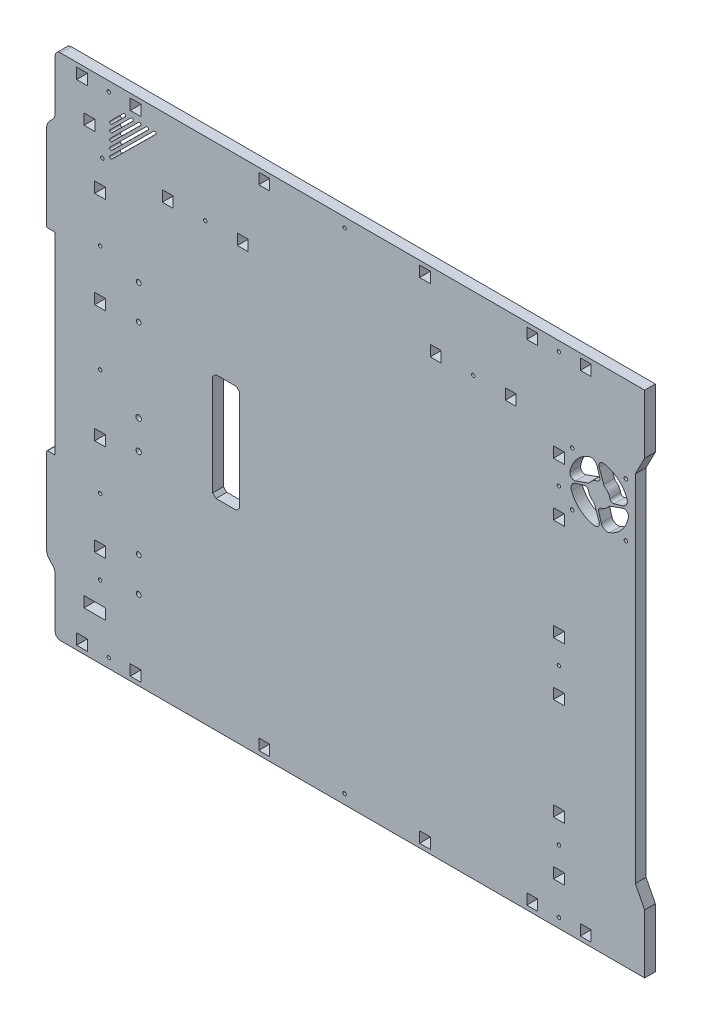
from build123d import *

# Parameters (mm, degrees)
SKETCH_1_R      = 1.6
SKETCH_1_R_2    = 2.25
SKETCH_1_R_3    = 2.5
SKETCH_1_W      = 10.1
SKETCH_1_H      = 10
SKETCH_1_W_2    = 10
SKETCH_1_H_2    = 10.1
SKETCH_1_W_3    = 20.1
EXTRUDE_1_DEPTH = 10


with BuildPart() as part:
    # Эскиз1 → Бобышка-Вытянуть1 (new body)
    with BuildSketch(Plane.XY):
        with BuildLine():
            Line((-929.093421233, 509.89377355), (-929.093421233, 464.03591955))
            ThreePointArc((-929.093421233, 464.03591955), (-929.854625881, 460.209077628), (-932.022357114, 456.964837669))
            Line((-932.022357114, 456.964837669), (-934.164489044, 454.822705739))
            ThreePointArc((-934.164489044, 454.822705739), (-936.332216558, 451.57847225), (-937.093421233, 447.751637925))
            Line((-937.093421233, 447.751637925), (-937.093421233, 368.393773551))
            ThreePointArc((-937.093421233, 368.393773551), (-936.800528014, 367.686666769), (-936.093421232, 367.39377355))
            Line((-936.093421232, 367.39377355), (-929.093421233, 367.39377355))
            Line((-929.093421233, 367.39377355), (-929.093421233, 187.39377355))
            Line((-929.093421233, 187.39377355), (-936.093421233, 187.39377355))
            ThreePointArc((-936.093421233, 187.39377355), (-936.800528014, 187.100880331), (-937.093421233, 186.39377355))
            Line((-937.093421233, 186.39377355), (-937.093421233, 107.035909174))
            ThreePointArc((-937.093421233, 107.035909174), (-936.332216558, 103.20907485), (-934.164489045, 99.964841362))
            Line((-934.164489045, 99.964841362), (-932.022353421, 97.822705738))
            ThreePointArc((-932.022353421, 97.822705738), (-929.854625836, 94.578472076), (-929.093421233, 90.75163755))
            Line((-929.093421233, 90.75163755), (-929.093421233, 44.89377355))
            ThreePointArc((-929.093421233, 44.89377355), (-927.628955139, 41.358239644), (-924.093421233, 39.89377355))
            Line((-924.093421233, 39.89377355), (-379.093421233, 39.89377355))
            Line((-379.093421233, 39.89377355), (-379.093421233, 94.89377355))
            Line((-379.093421233, 94.89377355), (-387.823678233, 111.89377355))
            Line((-387.823678233, 111.89377355), (-387.823678233, 442.89377355))
            Line((-387.823678233, 442.89377355), (-379.093421233, 459.89377355))
            Line((-379.093421233, 459.89377355), (-379.093421233, 514.89377355))
            Line((-379.093421233, 514.89377355), (-924.093421233, 514.89377355))
            ThreePointArc((-924.093421233, 514.89377355), (-927.628955139, 513.429307456), (-929.093421233, 509.89377355))
        make_face()
        with Locations((-887.143421236, 377.39377355)):
            Circle(SKETCH_1_R, mode=Mode.SUBTRACT)
        with Locations((-459.093421233, 48.843773546)):
            Circle(SKETCH_1_R, mode=Mode.SUBTRACT)
        with Locations((-659.093421233, 48.843773546)):
            Circle(SKETCH_1_R, mode=Mode.SUBTRACT)
        with Locations((-887.143421236, 177.39377355)):
            Circle(SKETCH_1_R, mode=Mode.SUBTRACT)
        with Locations((-885.143421235, 449.393773548)):
            Circle(SKETCH_1_R, mode=Mode.SUBTRACT)
        with Locations((-879.093421233, 505.943773546)):
            Circle(SKETCH_1_R, mode=Mode.SUBTRACT)
        with Locations((-659.093421233, 505.943773546)):
            Circle(SKETCH_1_R, mode=Mode.SUBTRACT)
        with Locations((-459.093421233, 505.943773546)):
            Circle(SKETCH_1_R, mode=Mode.SUBTRACT)
        with Locations((-879.093421233, 48.843773546)):
            Circle(SKETCH_1_R, mode=Mode.SUBTRACT)
        with Locations((-887.143421236, 107.39377355)):
            Circle(SKETCH_1_R, mode=Mode.SUBTRACT)
        with Locations((-459.141096235, 107.39377355)):
            Circle(SKETCH_1_R, mode=Mode.SUBTRACT)
        with Locations((-459.141096235, 397.39377355)):
            Circle(SKETCH_1_R, mode=Mode.SUBTRACT)
        with Locations((-887.143421236, 277.39377355)):
            Circle(SKETCH_1_R, mode=Mode.SUBTRACT)
        with Locations((-446.683386839, 434.428585952)):
            Circle(SKETCH_1_R, mode=Mode.SUBTRACT)
        with Locations((-446.683386839, 384.428585952)):
            Circle(SKETCH_1_R, mode=Mode.SUBTRACT)
        with Locations((-396.683386839, 384.428585952)):
            Circle(SKETCH_1_R, mode=Mode.SUBTRACT)
        with Locations((-396.683386839, 434.428585952)):
            Circle(SKETCH_1_R, mode=Mode.SUBTRACT)
        with Locations((-789.093421233, 446.843773548)):
            Circle(SKETCH_1_R, mode=Mode.SUBTRACT)
        with Locations((-539.093421233, 446.843773548)):
            Circle(SKETCH_1_R, mode=Mode.SUBTRACT)
        with Locations((-459.141096235, 252.39377355)):
            Circle(SKETCH_1_R, mode=Mode.SUBTRACT)
        with Locations((-851.191096233, 113.89377355)):
            Circle(SKETCH_1_R_2, mode=Mode.SUBTRACT)
        with Locations((-851.191096233, 365.89377355)):
            Circle(SKETCH_1_R_2, mode=Mode.SUBTRACT)
        with Locations((-851.191096233, 333.89377355)):
            Circle(SKETCH_1_R_2, mode=Mode.SUBTRACT)
        with Locations((-851.191096233, 145.89377355)):
            Circle(SKETCH_1_R_2, mode=Mode.SUBTRACT)
        with Locations((-851.191096233, 256.39377355)):
            Circle(SKETCH_1_R_3, mode=Mode.SUBTRACT)
        with Locations((-851.191096233, 229.39377355)):
            Circle(SKETCH_1_R_3, mode=Mode.SUBTRACT)
        with Locations((-459.141096233, 422.39377355)):
            Rectangle(SKETCH_1_W, SKETCH_1_H, mode=Mode.SUBTRACT)
        with Locations((-459.141096233, 372.39377355)):
            Rectangle(SKETCH_1_W, SKETCH_1_H, mode=Mode.SUBTRACT)
        with Locations((-459.141096233, 132.39377355)):
            Rectangle(SKETCH_1_W, SKETCH_1_H, mode=Mode.SUBTRACT)
        with Locations((-459.141096233, 82.39377355)):
            Rectangle(SKETCH_1_W, SKETCH_1_H, mode=Mode.SUBTRACT)
        with Locations((-734.093421233, 505.94377355)):
            Rectangle(SKETCH_1_W_2, SKETCH_1_H_2, mode=Mode.SUBTRACT)
        with Locations((-734.093421233, 48.84377355)):
            Rectangle(SKETCH_1_W_2, SKETCH_1_H_2, mode=Mode.SUBTRACT)
        with Locations((-434.093421233, 48.84377355)):
            Rectangle(SKETCH_1_W_2, SKETCH_1_H_2, mode=Mode.SUBTRACT)
        with Locations((-434.093421233, 505.94377355)):
            Rectangle(SKETCH_1_W_2, SKETCH_1_H_2, mode=Mode.SUBTRACT)
        with Locations((-584.093421233, 505.94377355)):
            Rectangle(SKETCH_1_W_2, SKETCH_1_H_2, mode=Mode.SUBTRACT)
        with Locations((-584.093421233, 48.84377355)):
            Rectangle(SKETCH_1_W_2, SKETCH_1_H_2, mode=Mode.SUBTRACT)
        with Locations((-904.093421233, 505.94377355)):
            Rectangle(SKETCH_1_W_2, SKETCH_1_H_2, mode=Mode.SUBTRACT)
        with Locations((-904.093421233, 48.84377355)):
            Rectangle(SKETCH_1_W_2, SKETCH_1_H_2, mode=Mode.SUBTRACT)
        with Locations((-854.093421233, 505.94377355)):
            Rectangle(SKETCH_1_W_2, SKETCH_1_H_2, mode=Mode.SUBTRACT)
        with Locations((-854.093421233, 48.84377355)):
            Rectangle(SKETCH_1_W_2, SKETCH_1_H_2, mode=Mode.SUBTRACT)
        with Locations((-484.093421233, 505.94377355)):
            Rectangle(SKETCH_1_W_2, SKETCH_1_H_2, mode=Mode.SUBTRACT)
        with Locations((-484.093421233, 48.84377355)):
            Rectangle(SKETCH_1_W_2, SKETCH_1_H_2, mode=Mode.SUBTRACT)
        with Locations((-887.143421233, 422.39377355)):
            Rectangle(SKETCH_1_W, SKETCH_1_H, mode=Mode.SUBTRACT)
        with Locations((-892.143421233, 82.39377355)):
            Rectangle(SKETCH_1_W_3, SKETCH_1_H, mode=Mode.SUBTRACT)
        with Locations((-887.143421233, 332.39377355)):
            Rectangle(SKETCH_1_W, SKETCH_1_H, mode=Mode.SUBTRACT)
        with Locations((-897.143421233, 472.39377355)):
            Rectangle(SKETCH_1_W, SKETCH_1_H, mode=Mode.SUBTRACT)
        with Locations((-887.143421233, 132.39377355)):
            Rectangle(SKETCH_1_W, SKETCH_1_H, mode=Mode.SUBTRACT)
        with Locations((-887.143421233, 222.39377355)):
            Rectangle(SKETCH_1_W, SKETCH_1_H, mode=Mode.SUBTRACT)
        with BuildLine():
            Line((-858.328175233, 495.28288155), (-877.880747233, 475.94517355))
            ThreePointArc((-877.880747233, 475.94517355), (-877.890513233, 474.17743355), (-876.122773233, 474.16766755))
            Line((-876.122773233, 474.16766755), (-856.570202233, 493.50537555))
            ThreePointArc((-856.570202233, 493.50537555), (-856.560435733, 495.27311505), (-858.328175233, 495.28288155))
        make_face(mode=Mode.SUBTRACT)
        with BuildLine():
            Line((-851.257215233, 495.24381555), (-877.919813233, 468.87421355))
            ThreePointArc((-877.919813233, 468.87421355), (-877.929579233, 467.10647355), (-876.161839233, 467.09670755))
            Line((-876.161839233, 467.09670755), (-849.499242233, 493.46630855))
            ThreePointArc((-849.499242233, 493.46630855), (-849.489475233, 495.23404855), (-851.257215233, 495.24381555))
        make_face(mode=Mode.SUBTRACT)
        with BuildLine():
            Line((-844.186255233, 495.20474955), (-877.958879233, 461.80325355))
            ThreePointArc((-877.958879233, 461.80325355), (-877.968645233, 460.03551355), (-876.200905233, 460.02574755))
            Line((-876.200905233, 460.02574755), (-842.428282233, 493.42724255))
            ThreePointArc((-842.428282233, 493.42724255), (-842.418515233, 495.19498255), (-844.186255233, 495.20474955))
        make_face(mode=Mode.SUBTRACT)
        with BuildLine():
            Line((-865.399135233, 495.32194755), (-877.841680233, 483.01613355))
            ThreePointArc((-877.841680233, 483.01613355), (-877.851447233, 481.24839355), (-876.083707233, 481.23862655))
            Line((-876.083707233, 481.23862655), (-863.641162233, 493.54444155))
            ThreePointArc((-863.641162233, 493.54444155), (-863.631395733, 495.31218105), (-865.399135233, 495.32194755))
        make_face(mode=Mode.SUBTRACT)
        with BuildLine():
            Line((-837.115295233, 495.16568355), (-877.997945233, 454.73229355))
            ThreePointArc((-877.997945233, 454.73229355), (-878.007711233, 452.96455355), (-876.239971233, 452.95478755))
            Line((-876.239971233, 452.95478755), (-835.357322233, 493.38817655))
            ThreePointArc((-835.357322233, 493.38817655), (-835.347555233, 495.15591655), (-837.115295233, 495.16568355))
        make_face(mode=Mode.SUBTRACT)
        with BuildLine():
            Line((-399.539905644, 409.221839367), (-411.183069054, 405.065078589))
            ThreePointArc((-411.183069054, 405.065078589), (-412.282484032, 404.464226206), (-413.142089647, 403.552735632))
            ThreePointArc((-413.142089647, 403.552735632), (-415.988899826, 400.766347373), (-419.688045631, 399.288305412))
            ThreePointArc((-419.688045631, 399.288305412), (-421.694837974, 397.914928206), (-422.024651545, 395.505653736))
            Line((-422.024651545, 395.505653736), (-419.667803229, 387.347850599))
            ThreePointArc((-419.667803229, 387.347850599), (-416.593086965, 383.649757054), (-411.790357577, 383.397633294))
            ThreePointArc((-411.790357577, 383.397633294), (-400.145093494, 391.74928922), (-394.247315867, 404.809861617))
            ThreePointArc((-394.247315867, 404.809861617), (-395.633747128, 408.52717755), (-399.539905644, 409.221839367))
        make_face(mode=Mode.SUBTRACT)
        with BuildLine():
            Line((-443.532023242, 409.340487651), (-431.888858878, 413.497247383))
            ThreePointArc((-431.888858878, 413.497247383), (-430.789443697, 414.098099757), (-429.929837927, 415.009590423))
            ThreePointArc((-429.929837927, 415.009590423), (-427.083027946, 417.795978469), (-423.383882448, 419.274020417))
            ThreePointArc((-423.383882448, 419.274020417), (-421.377090162, 420.6473977), (-421.047276682, 423.056672176))
            Line((-421.047276682, 423.056672176), (-423.404125673, 431.214476535))
            ThreePointArc((-423.404125673, 431.214476535), (-426.478842018, 434.912569941), (-431.281571357, 435.164693594))
            ThreePointArc((-431.281571357, 435.164693594), (-442.926835116, 426.813037703), (-448.824612618, 413.752465561))
            ThreePointArc((-448.824612618, 413.752465561), (-447.438181529, 410.035149751), (-443.532023242, 409.340487651))
        make_face(mode=Mode.SUBTRACT)
        with BuildLine():
            Line((-421.476640331, 431.27722225), (-417.319879462, 419.634057789))
            ThreePointArc((-417.319879462, 419.634057789), (-416.719027081, 418.534642769), (-415.807536488, 417.675037122))
            ThreePointArc((-415.807536488, 417.675037122), (-413.021148441, 414.828227243), (-411.543106427, 411.12908185))
            ThreePointArc((-411.543106427, 411.12908185), (-410.16972917, 409.122289655), (-407.760454788, 408.792476139))
            Line((-407.760454788, 408.792476139), (-399.602651327, 411.149324549))
            ThreePointArc((-399.602651327, 411.149324549), (-395.904557782, 414.224040813), (-395.652434022, 419.0267702))
            ThreePointArc((-395.652434022, 419.0267702), (-404.004090043, 430.672034362), (-417.064662588, 436.56981195))
            ThreePointArc((-417.064662588, 436.56981195), (-420.781978469, 435.183380703), (-421.476640331, 431.27722225))
        make_face(mode=Mode.SUBTRACT)
        with BuildLine():
            Line((-421.579768269, 387.296319461), (-425.736529137, 398.939483921))
            ThreePointArc((-425.736529137, 398.939483921), (-426.337381518, 400.038898942), (-427.248872111, 400.898504588))
            ThreePointArc((-427.248872111, 400.898504588), (-430.03526035, 403.745314762), (-431.5133023, 407.444460551))
            ThreePointArc((-431.5133023, 407.444460551), (-432.886679507, 409.451252894), (-435.295953976, 409.781066465))
            Line((-435.295953976, 409.781066465), (-443.453757592, 407.42421801))
            ThreePointArc((-443.453757592, 407.42421801), (-447.15185108, 404.349501859), (-447.403974985, 399.546772594))
            ThreePointArc((-447.403974985, 399.546772594), (-439.052319004, 387.901507716), (-425.991746012, 382.00372976))
            ThreePointArc((-425.991746012, 382.00372976), (-422.274430131, 383.390161008), (-421.579768269, 387.296319461))
        make_face(mode=Mode.SUBTRACT)
        with Locations((-824.093421233, 446.84377355)):
            Rectangle(SKETCH_1_W_2, SKETCH_1_H_2, mode=Mode.SUBTRACT)
        with Locations((-504.093421233, 446.84377355)):
            Rectangle(SKETCH_1_W_2, SKETCH_1_H_2, mode=Mode.SUBTRACT)
        with Locations((-754.093421233, 446.84377355)):
            Rectangle(SKETCH_1_W_2, SKETCH_1_H_2, mode=Mode.SUBTRACT)
        with Locations((-574.093421233, 446.84377355)):
            Rectangle(SKETCH_1_W_2, SKETCH_1_H_2, mode=Mode.SUBTRACT)
        with Locations((-459.141096233, 277.39377355)):
            Rectangle(SKETCH_1_W, SKETCH_1_H, mode=Mode.SUBTRACT)
        with Locations((-459.141096233, 227.39377355)):
            Rectangle(SKETCH_1_W, SKETCH_1_H, mode=Mode.SUBTRACT)
        Polygon((-782.093421233, 324.39377355), (-782.093421233, 230.39377355), (-779.093421233, 227.39377355), (-760.093421233, 227.39377355), (-757.093421233, 230.39377355), (-757.093421233, 324.39377355), (-760.093421233, 327.39377355), (-779.093421233, 327.39377355), align=None, mode=Mode.SUBTRACT)
    extrude(amount=EXTRUDE_1_DEPTH)


solid = part.part
